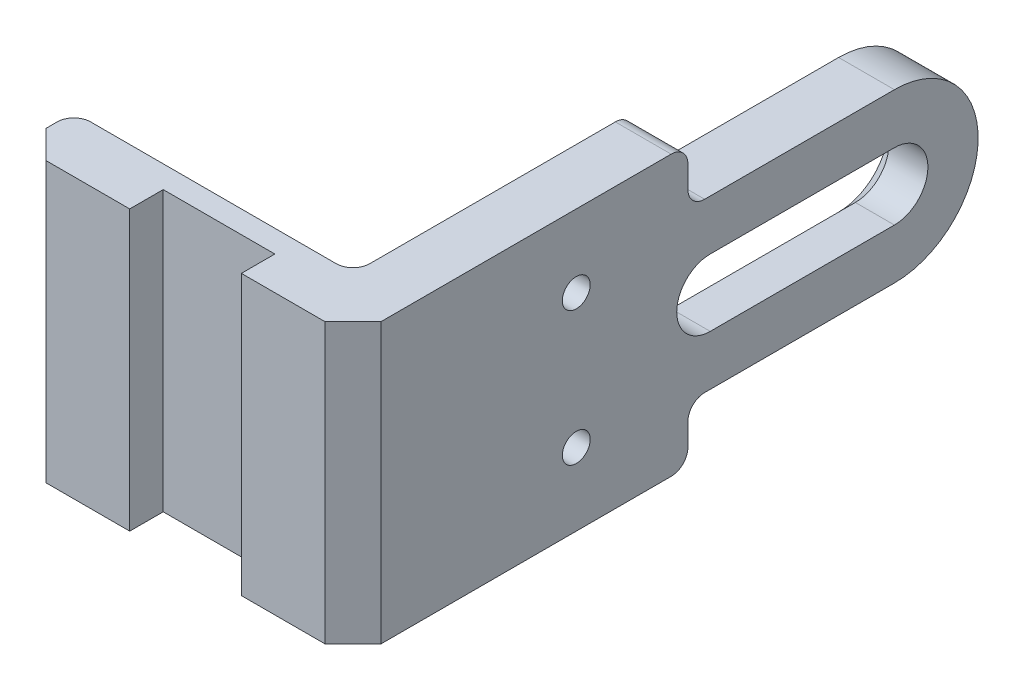
from build123d import *

# Parameters (mm, degrees)
BOSS_EXTRUDE1_DEPTH = 25
CUT_EXTRUDE1_DEPTH  = 25
CUT_EXTRUDE2_DEPTH  = 25
FILLET1_R           = 1.5
SKETCH5_R           = 1.25
CUT_EXTRUDE4_DEPTH  = 25
CUT_EXTRUDE5_START  = -2.5
SKETCH5_4_R         = 3
SKETCH5_4_R_2       = 1.25
CUT_EXTRUDE5_DEPTH  = 2.5
SKETCH7_W           = 10
SKETCH7_H           = 3
CUT_EXTRUDE6_DEPTH  = 69.271516755
CHAMFER1_SIZE       = 2.5
FILLET2_R           = 1.5
CHAMFER2_SIZE       = 1.5


with BuildPart() as part:
    # Sketch1 → Boss-Extrude1 (new body)
    with BuildSketch(Plane(origin=(0, 0, 0), x_dir=(1, 0, 0), z_dir=(0, 1, 0))):
        Polygon((0, 0), (-30, 0), (-30, 5), (-5, 5), (-5, 56), (0, 56), align=None)
    extrude(amount=BOSS_EXTRUDE1_DEPTH)

    # Sketch2 → Cut-Extrude1 (cut)
    with BuildSketch(Plane(origin=(0, 0, 0), x_dir=(0, 0, -1), z_dir=(1, 0, 0))):
        with BuildLine():
            Line((56, 25), (30, 25))
            Line((30, 25), (30, 20))
            Line((30, 20), (48.5, 20))
            ThreePointArc((48.5, 20), (53.803300859, 17.803300859), (56, 12.5))
            Line((56, 12.5), (56, 25))
        make_face()
        with BuildLine():
            ThreePointArc((56, 12.5), (53.803300859, 7.196699141), (48.5, 5))
            Line((48.5, 5), (30, 5))
            Line((30, 5), (30, 0))
            Line((30, 0), (56, 0))
            Line((56, 0), (56, 12.5))
        make_face()
    extrude(amount=-CUT_EXTRUDE1_DEPTH, mode=Mode.SUBTRACT)

    # Sketch3 → Cut-Extrude2 (cut)
    with BuildSketch(Plane(origin=(0, 0, 0), x_dir=(0, 0, -1), z_dir=(1, 0, 0))):
        with BuildLine():
            Line((32, 15.5), (48.5, 15.5))
            ThreePointArc((48.5, 15.5), (51.5, 12.5), (48.5, 9.5))
            Line((48.5, 9.5), (32, 9.5))
            ThreePointArc((32, 9.5), (29, 12.5), (32, 15.5))
        make_face()
    extrude(amount=-CUT_EXTRUDE2_DEPTH, mode=Mode.SUBTRACT)

    # Fillet1
    fillet1_edges = [part.edges().sort_by_distance(p)[0] for p in [
        (-2.5, 20, -30),
        (-2.5, 5, -30),
        (-2.5, 0, -30),
        (-2.5, 25, -30),
    ]]
    fillet(fillet1_edges, radius=FILLET1_R)

    # Sketch5 → Cut-Extrude4 (cut)
    with BuildSketch(Plane(origin=(0, 0, 0), x_dir=(0, 0, -1), z_dir=(1, 0, 0))):
        with Locations((20, 18.5)):
            Circle(SKETCH5_R)
        with Locations((20, 6.5)):
            Circle(SKETCH5_R)
    extrude(amount=-CUT_EXTRUDE4_DEPTH, mode=Mode.SUBTRACT)

    # Sketch5<4> → Cut-Extrude5 (cut)
    # profile 1 of 2: a face of its own
    with BuildSketch(Plane(origin=(0, 0, 0), x_dir=(0, 0, -1), z_dir=(1, 0, 0)).offset(CUT_EXTRUDE5_START)):
        with Locations((20, 18.5)):
            Circle(SKETCH5_4_R)
        with Locations((20, 18.5)):
            Circle(SKETCH5_4_R_2, mode=Mode.SUBTRACT)
    # profile 2 of 2: a face of its own
    with BuildSketch(Plane(origin=(0, 0, 0), x_dir=(0, 0, -1), z_dir=(1, 0, 0)).offset(CUT_EXTRUDE5_START)):
        with Locations((20, 6.5)):
            Circle(SKETCH5_4_R)
        with Locations((20, 6.5)):
            Circle(SKETCH5_4_R_2, mode=Mode.SUBTRACT)
    extrude(amount=-CUT_EXTRUDE5_DEPTH, mode=Mode.SUBTRACT)

    # Sketch7 → Cut-Extrude6 (cut, through all)
    with BuildSketch(Plane(origin=(0, 25, 0), x_dir=(1, 0, 0), z_dir=(0, 1, 0))):
        with Locations((-15, 1.5)):
            Rectangle(SKETCH7_W, SKETCH7_H)
    extrude(amount=-CUT_EXTRUDE6_DEPTH, mode=Mode.SUBTRACT)

    # Chamfer1
    chamfer1_edges = [part.edges().sort_by_distance(p)[0] for p in [
        (0, 12.5, 0),
        (-30, 12.5, 0),
    ]]
    chamfer(chamfer1_edges, length=CHAMFER1_SIZE)

    # Fillet2
    fillet2_edges = [part.edges().sort_by_distance(p)[0] for p in [
        (-30, 12.5, -5),
        (-5, 12.5, -5),
    ]]
    fillet(fillet2_edges, radius=FILLET2_R)

    # Chamfer2
    chamfer2_edges = [part.edges().sort_by_distance(p)[0] for p in [
        (-5, 9.5, -40.25),
        (-5, 12.5, -51.5),
        (-5, 12.5, -29),
        (-5, 15.5, -40.25),
    ]]
    chamfer(chamfer2_edges, length=CHAMFER2_SIZE)


solid = part.part
